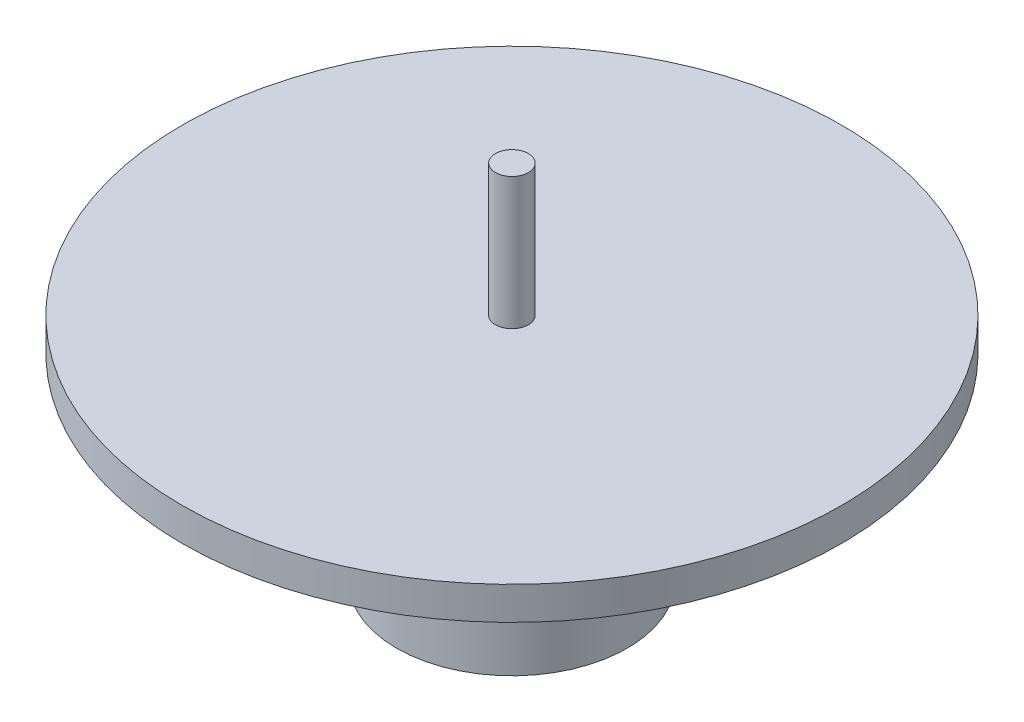
from build123d import *

# Parameters (mm, degrees)
ESQUISSE1_R        = 3.5
BOSS_EXTRU_1_DEPTH = 5
ESQUISSE4_R        = 5.5
BOSS_EXTRU_3_DEPTH = 1
ESQUISSE5_R        = 10
BOSS_EXTRU_4_DEPTH = 1
ESQUISSE6_R        = 0.5
BOSS_EXTRU_5_DEPTH = 4


with BuildPart() as part:
    # Esquisse1 → Boss.-Extru.1 (new body)
    with BuildSketch(Plane(origin=(0, 0, 0), x_dir=(1, 0, 0), z_dir=(0, 1, 0))):
        with Locations(Location((0, 0, 0), (0, 0, 270))):
            Circle(ESQUISSE1_R)
    extrude(amount=BOSS_EXTRU_1_DEPTH)

    # Esquisse4 → Boss.-Extru.3 (add)
    with BuildSketch(Plane(origin=(0, 5, 0), x_dir=(1, 0, 0), z_dir=(0, 1, 0))):
        with Locations(Location((0, 0, 0), (0, 0, 270))):
            Circle(ESQUISSE4_R)
    extrude(amount=BOSS_EXTRU_3_DEPTH)

    # Esquisse5 → Boss.-Extru.4 (add)
    with BuildSketch(Plane(origin=(0, 6, 0), x_dir=(1, 0, 0), z_dir=(0, 1, 0))):
        with Locations(Location((0, 0, 0), (0, 0, 270))):
            Circle(ESQUISSE5_R)
    extrude(amount=BOSS_EXTRU_4_DEPTH)

    # Esquisse6 → Boss.-Extru.5 (add)
    with BuildSketch(Plane(origin=(0, 7, 0), x_dir=(1, 0, 0), z_dir=(0, 1, 0))):
        with Locations(Location((0, 0, 0), (0, 0, 270))):
            Circle(ESQUISSE6_R)
    extrude(amount=BOSS_EXTRU_5_DEPTH)


solid = part.part
